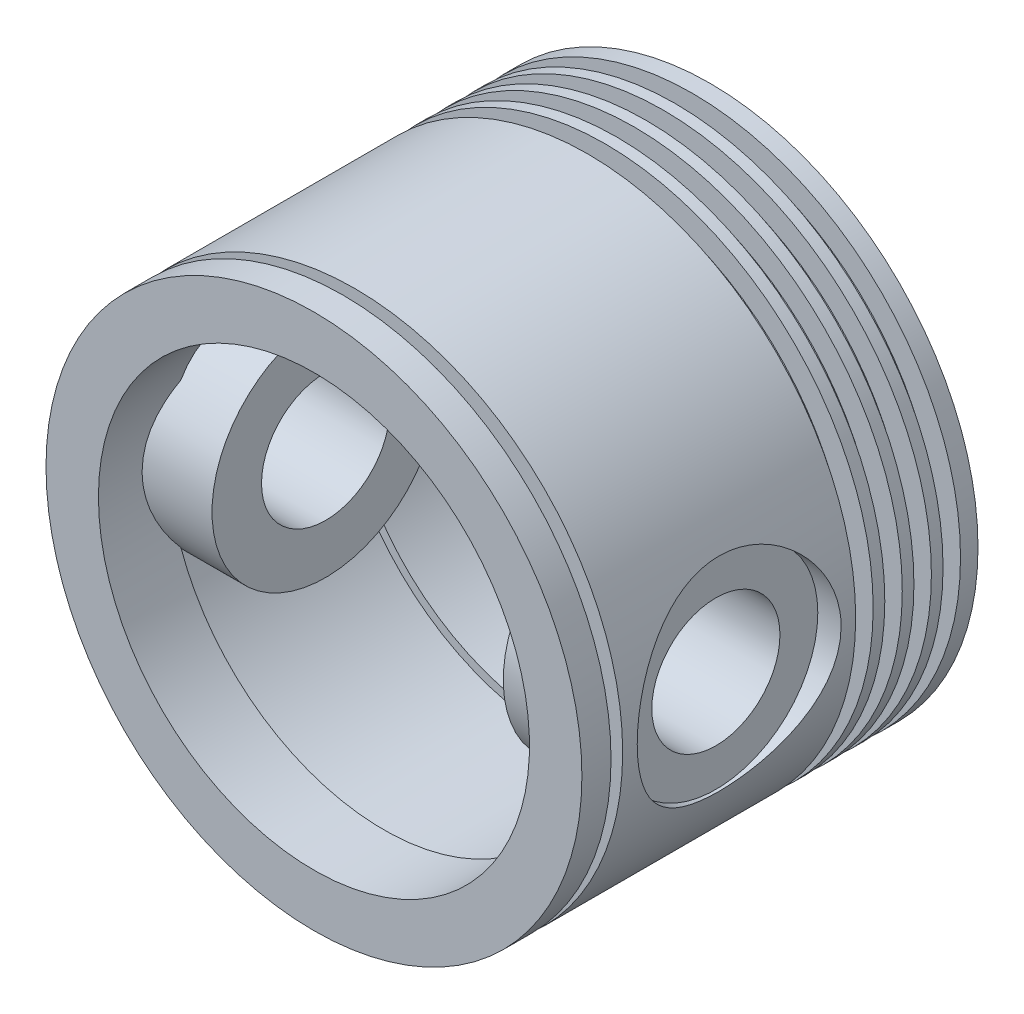
from build123d import *

# Parameters (mm, degrees)
SKETCH2_W                = 1.5
SKETCH2_H                = 30
BOSS_EXTRUDE1_REACH      = 125.292
BOSS_EXTRUDE1_END_RADIUS = 38.5
BOSS_EXTRUDE1_START      = 25
SKETCH4_R                = 19.5
SKETCH5_R                = 11
CUT_EXTRUDE1_DEPTH       = 60.5
CUT_EXTRUDE4_REACH       = 131.188
CUT_EXTRUDE4_END_RADIUS  = 46
CUT_EXTRUDE4_START       = -17
SKETCH6_R                = 17.5
SKETCH8_W                = 4
SKETCH8_H                = 3
LPATTERN1_COUNT          = 4
LPATTERN1_PITCH          = 5
SKETCH9_W                = 4
SKETCH9_H                = 2


with BuildPart() as part:
    # Sketch1 → Revolve1 (revolve)
    with BuildSketch(Plane(origin=(0, 0, 0), x_dir=(1, 0, 0), z_dir=(0, 1, 0)), mode=Mode.PRIVATE) as revolve1_sk:
        with BuildLine():
            Line((0, 62), (37, 62))
            Line((37, 62), (37, 0))
            Line((37, 0), (46, 0))
            Line((46, 0), (46, 68))
            ThreePointArc((46, 68), (23.174880185, 72.257119382), (0, 73.683334091))
            Line((0, 73.683334091), (0, 62))
        make_face()
    revolve(revolve1_sk.sketch.rotate(Axis((0, 0, -90.728712871), (0, 0, 1)), 180), axis=Axis((0, 0, -90.728712871), (0, 0, 1)))

    # Sketch2 → Cut-Revolve1 (revolve, cut)
    with BuildSketch(Plane(origin=(0, 0, 0), x_dir=(1, 0, 0), z_dir=(0, 1, 0)), mode=Mode.PRIVATE) as cut_revolve1_sk:
        with Locations((37.75, 27)):
            Rectangle(SKETCH2_W, SKETCH2_H)
    revolve(cut_revolve1_sk.sketch.rotate(Axis((0, 0, 0), (0, 0, -1)), 180), axis=Axis((0, 0, 0), (0, 0, -1)), mode=Mode.SUBTRACT)

    # Boss-Extrude1: up to this cylinder (the profile starts inside it)
    boss_extrude1_end = Plane(origin=(0, 0, -27), z_dir=(0, 0, 1)) * Cylinder(BOSS_EXTRUDE1_END_RADIUS, 328.584, mode=Mode.PRIVATE)
    # Sketch4 → Boss-Extrude1 (add, up to the surface)
    with BuildSketch(Plane(origin=(0, 0, 0), x_dir=(0, 0, -1), z_dir=(1, 0, 0)).offset(BOSS_EXTRUDE1_START), mode=Mode.PRIVATE) as boss_extrude1_sk1:
        with Locations(Location((27, 0, 0), (0, 0, 219.715136976))):
            Circle(SKETCH4_R)
    boss_extrude1_tool1 = extrude(boss_extrude1_sk1.sketch, amount=BOSS_EXTRUDE1_REACH, mode=Mode.PRIVATE) & boss_extrude1_end
    boss_extrude1 = boss_extrude1_tool1.solids().sort_by_distance((25, 0, -27))[0]
    add(boss_extrude1)

    # Mirror1: Boss-Extrude1 across plane
    add(boss_extrude1.mirror(Plane(origin=(0, 0, 0), x_dir=(0, 0, 1), z_dir=(1, 0, 0))))

    # Sketch5 → Cut-Extrude1 (cut, symmetric)
    with BuildSketch(Plane(origin=(0, 0, 0), x_dir=(0, 0, -1), z_dir=(1, 0, 0))):
        with Locations(Location((27, 0, 0), (0, 0, 180))):
            Circle(SKETCH5_R)
    extrude(amount=CUT_EXTRUDE1_DEPTH, both=True, mode=Mode.SUBTRACT)

    # Cut-Extrude4: up to this cylinder (the profile starts inside it)
    cut_extrude4_end = Plane(origin=(0, 0, -27), z_dir=(0, 0, -1)) * Cylinder(CUT_EXTRUDE4_END_RADIUS, 355.376, mode=Mode.PRIVATE)
    # Sketch6 → Cut-Extrude4 (cut, up to the surface)
    with BuildSketch(Plane(origin=(-25, 0, 0), x_dir=(0, 0, -1), z_dir=(1, 0, 0)).offset(CUT_EXTRUDE4_START), mode=Mode.PRIVATE) as cut_extrude4_sk1:
        with Locations((27, 0)):
            Circle(SKETCH6_R)
    cut_extrude4_tool1 = extrude(cut_extrude4_sk1.sketch, amount=-CUT_EXTRUDE4_REACH, mode=Mode.PRIVATE) & cut_extrude4_end
    cut_extrude4 = cut_extrude4_tool1.solids().sort_by_distance((-42, 0, -27))[0]
    add(cut_extrude4, mode=Mode.SUBTRACT)

    # Mirror2: Cut-Extrude4 across plane
    add(cut_extrude4.mirror(Plane(origin=(0, 0, 0), x_dir=(0, 0, 1), z_dir=(1, 0, 0))), mode=Mode.SUBTRACT)

    # Sketch8 → Cut-Revolve2 (revolve, cut)
    with BuildSketch(Plane(origin=(0, 0, 0), x_dir=(1, 0, 0), z_dir=(0, 1, 0)), mode=Mode.PRIVATE) as cut_revolve2_sk:
        with Locations((44, 63.5)):
            Rectangle(SKETCH8_W, SKETCH8_H)
    cut_revolve2 = revolve(cut_revolve2_sk.sketch.rotate(Axis((0, 0, 0), (0, 0, -1)), 180), axis=Axis((0, 0, 0), (0, 0, -1)), mode=Mode.SUBTRACT)

    # LPattern1: Cut-Revolve2 ×4
    with Locations(*[(0, 0, i * LPATTERN1_PITCH) for i in range(1, LPATTERN1_COUNT)]):
        add(cut_revolve2, mode=Mode.SUBTRACT)

    # Sketch9 → Cut-Revolve3 (revolve, cut)
    with BuildSketch(Plane(origin=(0, 0, 0), x_dir=(1, 0, 0), z_dir=(0, 1, 0)), mode=Mode.PRIVATE) as cut_revolve3_sk:
        with Locations((-44, 6)):
            Rectangle(SKETCH9_W, SKETCH9_H)
    revolve(cut_revolve3_sk.sketch.rotate(Axis((0, 0, 0), (0, 0, -1)), 180), axis=Axis((0, 0, 0), (0, 0, -1)), mode=Mode.SUBTRACT)


solid = part.part
